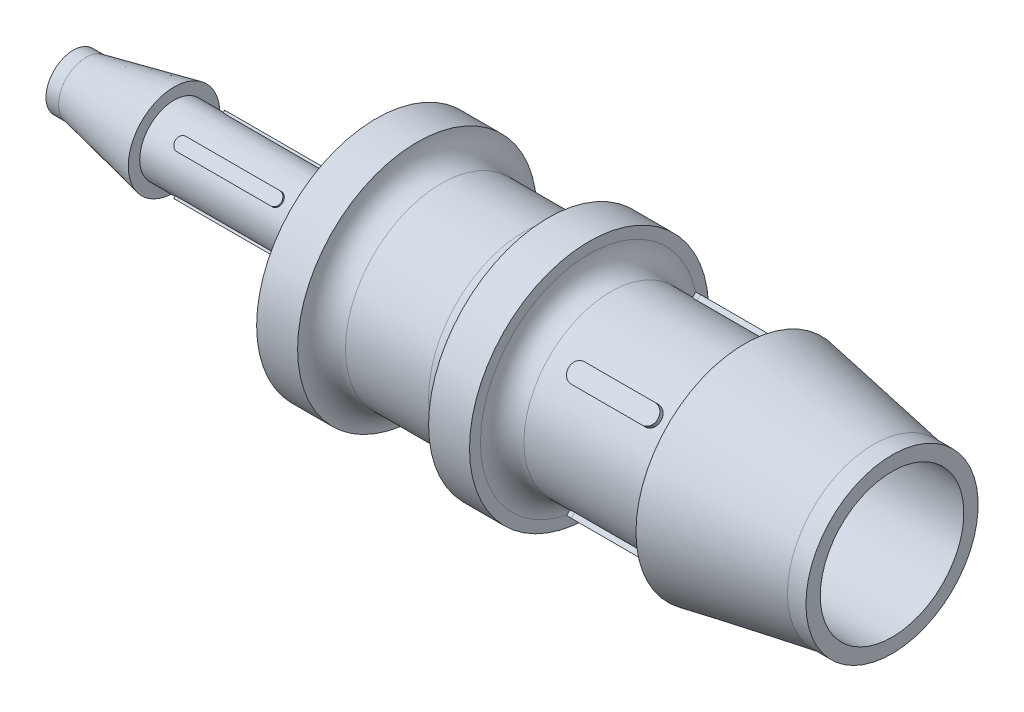
from build123d import *

# Parameters (mm, degrees)
EXTRUDE1_DEPTH     = 7.595616
EXTRUDE2_DEPTH     = 3.000375
CIRPATTERN1_COUNT  = 2
CIRPATTERN1_ANGLE  = 90
SKETCH4_R          = 5.969
CUT_EXTRUDE1_DEPTH = 39.496492
SKETCH7_R          = 1.8161
CUT_EXTRUDE2_DEPTH = 70.535078783


with BuildPart() as part:
    # Sketch1 → Revolve1 (revolve)
    with BuildSketch(Plane.XY, mode=Mode.PRIVATE) as revolve1_sk:
        Polygon((34.0487, 5.969), (34.0487, 7.1628), (32.5165085, 7.1628), (21.791168, 9.0424), (21.791168, 7.23392), (8.852662, 7.23392), (8.852662, 9.94664), (5.447792, 9.94664), (5.447792, 7.957312), (-5.447792, 7.957312), (-5.447792, 9.94664), (-8.852662, 9.94664), (-8.852662, 2.8575), (-25.6667, 2.8575), (-25.6667, 3.81), (-33.00095, 2.270125), (-34.0487, 2.270125), (-34.0487, 1.8161), (-5.447792, 1.8161), (-5.447792, 5.969), align=None)
    revolve(revolve1_sk.sketch.rotate(Axis((0, 0, 0), (1, 0, 0)), 90), axis=Axis((0, 0, 0), (1, 0, 0)))

    # Sketch2 → Revolve2 (revolve)
    with BuildSketch(Plane.XY, mode=Mode.PRIVATE) as revolve2_sk:
        with BuildLine():
            Line((10.661142, 7.23392), (8.852662, 7.23392))
            Line((8.852662, 7.23392), (8.852662, 9.0424))
            ThreePointArc((8.852662, 9.0424), (9.382353528, 7.763611528), (10.661142, 7.23392))
        make_face()
        with BuildLine():
            Line((5.447792, 9.94664), (5.447792, 7.957312))
            Line((5.447792, 7.957312), (3.458464, 7.957312))
            ThreePointArc((3.458464, 7.957312), (4.865131319, 8.539972681), (5.447792, 9.94664))
        make_face()
        with BuildLine():
            Line((-5.447792, 9.94664), (-5.447792, 7.957312))
            Line((-5.447792, 7.957312), (-3.458464, 7.957312))
            ThreePointArc((-3.458464, 7.957312), (-4.865131319, 8.539972681), (-5.447792, 9.94664))
        make_face()
        with BuildLine():
            Line((-12.397232, 2.8575), (-8.852662, 2.8575))
            Line((-8.852662, 2.8575), (-8.852662, 6.40207))
            ThreePointArc((-8.852662, 6.40207), (-9.890842517, 3.895680517), (-12.397232, 2.8575))
        make_face()
    revolve(revolve2_sk.sketch.rotate(Axis((0, 0, 0), (1, 0, 0)), 90), axis=Axis((0, 0, 0), (1, 0, 0)))

    # Sketch3 → Extrude1 (add, symmetric)
    with BuildSketch(Plane(origin=(0, 0, 0), x_dir=(-1, 0, 0), z_dir=(0, 0.7071067811865488, 0.7071067811865462))):
        with BuildLine():
            Line((-13.282242083, 0.76609575), (-19.170067917, 0.76609575))
            ThreePointArc((-19.170067917, 0.76609575), (-19.936163667, 0), (-19.170067917, -0.76609575))
            Line((-19.170067917, -0.76609575), (-13.282242083, -0.76609575))
            ThreePointArc((-13.282242083, -0.76609575), (-12.516146333, 0), (-13.282242083, 0.76609575))
        make_face()
    extrude1 = extrude(amount=EXTRUDE1_DEPTH, both=True)

    # Sketch6 → Extrude2 (add, symmetric)
    with BuildSketch(Plane(origin=(0, 0, 0), x_dir=(-1, 0, 0), z_dir=(0, 0.7071067811865488, 0.7071067811865462))):
        with BuildLine():
            Line((15.132685, 0.523875), (22.931247, 0.523875))
            ThreePointArc((22.931247, 0.523875), (23.455122, 0), (22.931247, -0.523875))
            Line((22.931247, -0.523875), (15.132685, -0.523875))
            ThreePointArc((15.132685, -0.523875), (14.60881, 0), (15.132685, 0.523875))
        make_face()
    extrude2 = extrude(amount=EXTRUDE2_DEPTH, both=True)

    # CirPattern1: Extrude1, Extrude2 ×2 about axis
    cirpattern1_axis = Axis((0, 0, 0), (1, 0, 0))
    add([extrude1.rotate(cirpattern1_axis, i * CIRPATTERN1_ANGLE / (CIRPATTERN1_COUNT - 1)) for i in range(1, CIRPATTERN1_COUNT)])
    add([extrude2.rotate(cirpattern1_axis, i * CIRPATTERN1_ANGLE / (CIRPATTERN1_COUNT - 1)) for i in range(1, CIRPATTERN1_COUNT)])

    # Sketch4 → Cut-Extrude1 (cut)
    with BuildSketch(Plane(origin=(34.0487, 0, 0), x_dir=(0, 0, -1), z_dir=(1, 0, 0))):
        with Locations(Location((0, 0, 0), (0, 0, 180))):
            Circle(SKETCH4_R)
    extrude(amount=-CUT_EXTRUDE1_DEPTH, mode=Mode.SUBTRACT)

    # Sketch7 → Cut-Extrude2 (cut, through all)
    with BuildSketch(Plane.ZY.offset(34.0487)):
        Circle(SKETCH7_R)
    extrude(amount=-CUT_EXTRUDE2_DEPTH, mode=Mode.SUBTRACT)


solid = part.part
